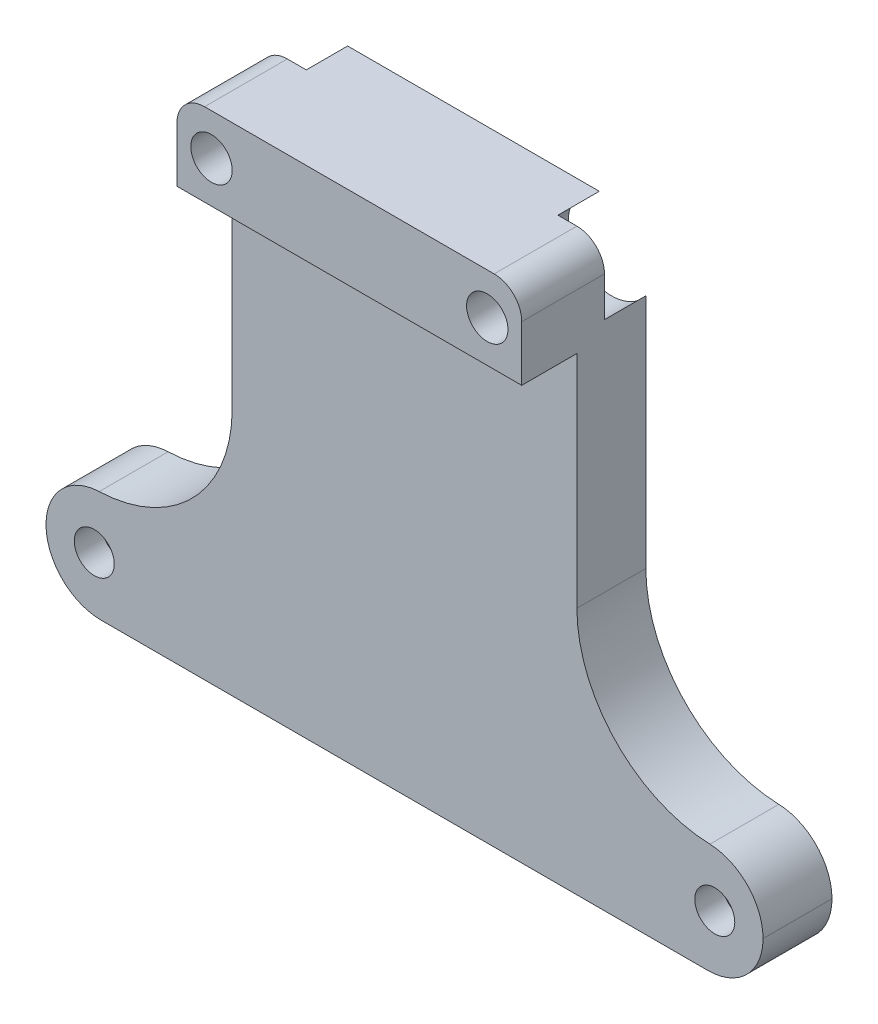
from build123d import *

# Parameters (mm, degrees)
SKETCH_1_W          = 52
SKETCH_1_H          = 8
SKETCH_1_R          = 1.45
EXTRUDE_1_DEPTH     = 5
SKETCH_2_W          = 25
SKETCH_2_H          = 32
SKETCH_2_R          = 1.5
EXTRUDE_2_DEPTH     = 5
SKETCH_3_W          = 25
SKETCH_3_H          = 6
SKETCH_3_R          = 1.5
EXTRUDE_3_DEPTH     = 4
FILLET_1_R          = 10
FILLET_2_R          = 4
FILLET_3_R          = 2
SKETCH_4_R          = 3.125
CUT_EXTRUDE_3_DEPTH = 3


with BuildPart() as part:
    # Эскиз1 → Бобышка-Вытянуть1 (new body)
    with BuildSketch(Plane.XY):
        Rectangle(SKETCH_1_W, SKETCH_1_H)
        with Locations((-22.5, 0)):
            Circle(SKETCH_1_R, mode=Mode.SUBTRACT)
        with Locations((22.5, 0)):
            Circle(SKETCH_1_R, mode=Mode.SUBTRACT)
    extrude(amount=EXTRUDE_1_DEPTH)

    # Эскиз2 → Бобышка-Вытянуть2 (add)
    with BuildSketch(Plane(origin=(0, 0, 0), x_dir=(-1, 0, 0), z_dir=(0, 0, -1))):
        with Locations((0, 20)):
            Rectangle(SKETCH_2_W, SKETCH_2_H)
        with Locations((-10, 33)):
            Circle(SKETCH_2_R, mode=Mode.SUBTRACT)
        with Locations((10, 33)):
            Circle(SKETCH_2_R, mode=Mode.SUBTRACT)
    extrude(amount=-EXTRUDE_2_DEPTH)

    # Эскиз3 → Бобышка-Вытянуть3 (add)
    with BuildSketch(Plane(origin=(0, 0, 5), x_dir=(-1, 0, 0), z_dir=(0, 0, -1))):
        with Locations((0, 33)):
            Rectangle(SKETCH_3_W, SKETCH_3_H)
        with Locations((10, 33)):
            Circle(SKETCH_3_R, mode=Mode.SUBTRACT)
        with Locations((-10, 33)):
            Circle(SKETCH_3_R, mode=Mode.SUBTRACT)
    extrude(amount=-EXTRUDE_3_DEPTH)

    # Скругление1
    fillet_1_edges = [part.edges().sort_by_distance(p)[0] for p in [
        (12.5, 4, 2.5),
        (-12.5, 4, 2.5),
    ]]
    fillet(fillet_1_edges, radius=FILLET_1_R)

    # Скругление2
    fillet_2_edges = [part.edges().sort_by_distance(p)[0] for p in [
        (-26, -4, 2.5),
        (-26, 4, 2.5),
        (26, -4, 2.5),
        (26, 4, 2.5),
    ]]
    fillet(fillet_2_edges, radius=FILLET_2_R)

    # Скругление3
    fillet_3_edges = [part.edges().sort_by_distance(p)[0] for p in [
        (12.5, 36, 4.5),
        (-12.5, 36, 4.5),
    ]]
    fillet(fillet_3_edges, radius=FILLET_3_R)

    # Эскиз4 → Вырез-Вытянуть3 (cut)
    with BuildSketch(Plane(origin=(0, 0, 0), x_dir=(-1, 0, 0), z_dir=(0, 0, -1))):
        with Locations((-10, 33)):
            Circle(SKETCH_4_R)
        with Locations((10, 33)):
            Circle(SKETCH_4_R)
        with Locations((-22.5, 0)):
            Circle(SKETCH_4_R)
        with Locations((22.5, 0)):
            Circle(SKETCH_4_R)
    extrude(amount=-CUT_EXTRUDE_3_DEPTH, mode=Mode.SUBTRACT)


solid = part.part
